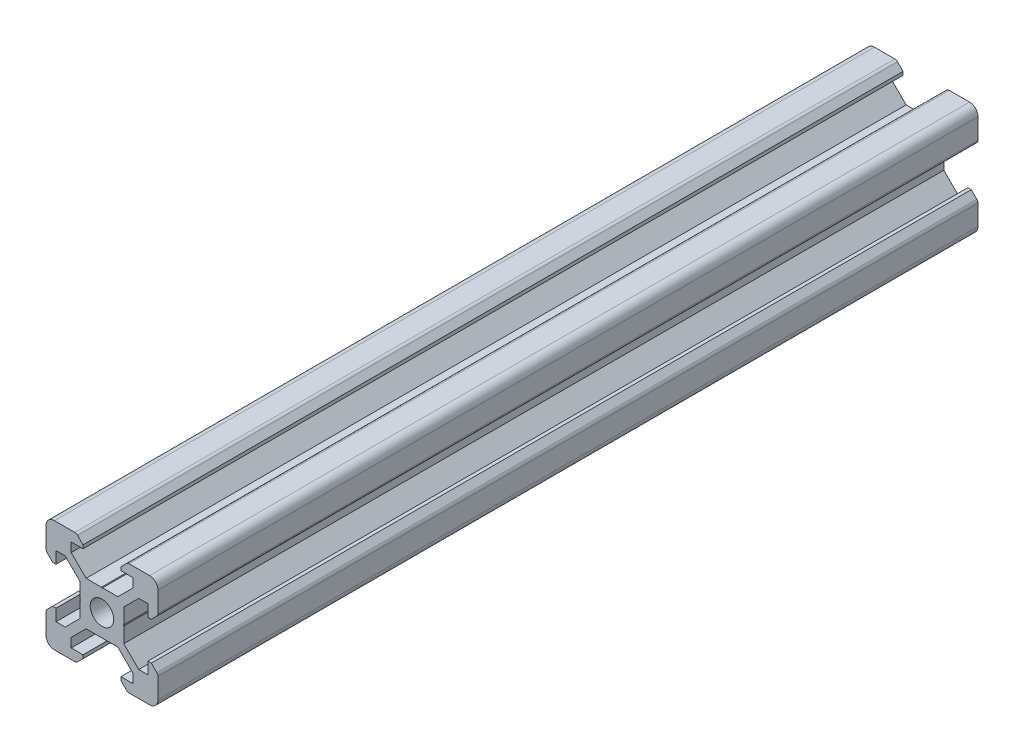
from build123d import *

# Parameters (mm, degrees)
SKETCH1_R           = 2.1
BOSS_EXTRUDE1_DEPTH = 146.5


with BuildPart() as part:
    # Sketch1 → Boss-Extrude1 (new body)
    with BuildSketch(Plane.XY):
        with BuildLine():
            Line((-8.5, 10), (-4.862792737, 10))
            ThreePointArc((-4.862792737, 10), (-4.598292737, 9.947387679), (-4.374060464, 9.797560464))
            Line((-4.374060464, 9.797560464), (-3.3865, 8.81))
            Line((-3.3865, 8.81), (-3.3865, 8.2))
            Line((-3.3865, 8.2), (-5.5, 8.2))
            Line((-5.5, 8.2), (-5.5, 6.561))
            Line((-5.5, 6.561), (-2.8395, 3.9005))
            Line((-2.8395, 3.9005), (-0.1, 3.9005))
            Line((-0.1, 3.9005), (0, 3.8005))
            Line((0, 3.8005), (0.1, 3.9005))
            Line((0.1, 3.9005), (2.8395, 3.9005))
            Line((2.8395, 3.9005), (5.5, 6.561))
            Line((5.5, 6.561), (5.5, 8.2))
            Line((5.5, 8.2), (3.3865, 8.2))
            Line((3.3865, 8.2), (3.3865, 8.81))
            Line((3.3865, 8.81), (4.374060464, 9.797560464))
            ThreePointArc((4.374060464, 9.797560464), (4.598292737, 9.947387679), (4.862792737, 10))
            Line((4.862792737, 10), (8.5, 10))
            ThreePointArc((8.5, 10), (9.560660172, 9.560660172), (10, 8.5))
            Line((10, 8.5), (10, 4.862792737))
            ThreePointArc((10, 4.862792737), (9.947387679, 4.598292737), (9.797560464, 4.374060464))
            Line((9.797560464, 4.374060464), (8.81, 3.3865))
            Line((8.81, 3.3865), (8.2, 3.3865))
            Line((8.2, 3.3865), (8.2, 5.5))
            Line((8.2, 5.5), (6.561, 5.5))
            Line((6.561, 5.5), (3.9005, 2.8395))
            Line((3.9005, 2.8395), (3.9005, 0.1))
            Line((3.9005, 0.1), (3.8005, 0))
            Line((3.8005, 0), (3.9005, -0.1))
            Line((3.9005, -0.1), (3.9005, -2.8395))
            Line((3.9005, -2.8395), (6.561, -5.5))
            Line((6.561, -5.5), (8.2, -5.5))
            Line((8.2, -5.5), (8.2, -3.3865))
            Line((8.2, -3.3865), (8.81, -3.3865))
            Line((8.81, -3.3865), (9.797560464, -4.374060464))
            ThreePointArc((9.797560464, -4.374060464), (9.947387679, -4.598292737), (10, -4.862792737))
            Line((10, -4.862792737), (10, -8.5))
            ThreePointArc((10, -8.5), (9.560660172, -9.560660172), (8.5, -10))
            Line((8.5, -10), (4.862792737, -10))
            ThreePointArc((4.862792737, -10), (4.598292737, -9.947387679), (4.374060464, -9.797560464))
            Line((4.374060464, -9.797560464), (3.3865, -8.81))
            Line((3.3865, -8.81), (3.3865, -8.2))
            Line((3.3865, -8.2), (5.5, -8.2))
            Line((5.5, -8.2), (5.5, -6.561))
            Line((5.5, -6.561), (2.8395, -3.9005))
            Line((2.8395, -3.9005), (0.1, -3.9005))
            Line((0.1, -3.9005), (0, -3.8005))
            Line((0, -3.8005), (-0.1, -3.9005))
            Line((-0.1, -3.9005), (-2.8395, -3.9005))
            Line((-2.8395, -3.9005), (-5.5, -6.561))
            Line((-5.5, -6.561), (-5.5, -8.2))
            Line((-5.5, -8.2), (-3.3865, -8.2))
            Line((-3.3865, -8.2), (-3.3865, -8.81))
            Line((-3.3865, -8.81), (-4.374060464, -9.797560464))
            ThreePointArc((-4.374060464, -9.797560464), (-4.598292737, -9.947387679), (-4.862792737, -10))
            Line((-4.862792737, -10), (-8.5, -10))
            ThreePointArc((-8.5, -10), (-9.560660172, -9.560660172), (-10, -8.5))
            Line((-10, -8.5), (-10, -4.862792737))
            ThreePointArc((-10, -4.862792737), (-9.947387679, -4.598292737), (-9.797560464, -4.374060464))
            Line((-9.797560464, -4.374060464), (-8.81, -3.3865))
            Line((-8.81, -3.3865), (-8.2, -3.3865))
            Line((-8.2, -3.3865), (-8.2, -5.5))
            Line((-8.2, -5.5), (-6.561, -5.5))
            Line((-6.561, -5.5), (-3.9005, -2.8395))
            Line((-3.9005, -2.8395), (-3.9005, -0.1))
            Line((-3.9005, -0.1), (-3.8005, 0))
            Line((-3.8005, 0), (-3.9005, 0.1))
            Line((-3.9005, 0.1), (-3.9005, 2.8395))
            Line((-3.9005, 2.8395), (-6.561, 5.5))
            Line((-6.561, 5.5), (-8.2, 5.5))
            Line((-8.2, 5.5), (-8.2, 3.3865))
            Line((-8.2, 3.3865), (-8.81, 3.3865))
            Line((-8.81, 3.3865), (-9.797560464, 4.374060464))
            ThreePointArc((-9.797560464, 4.374060464), (-9.947387679, 4.598292737), (-10, 4.862792737))
            Line((-10, 4.862792737), (-10, 8.5))
            ThreePointArc((-10, 8.5), (-9.560660172, 9.560660172), (-8.5, 10))
        make_face()
        Circle(SKETCH1_R, mode=Mode.SUBTRACT)
    extrude(amount=BOSS_EXTRUDE1_DEPTH)


solid = part.part
